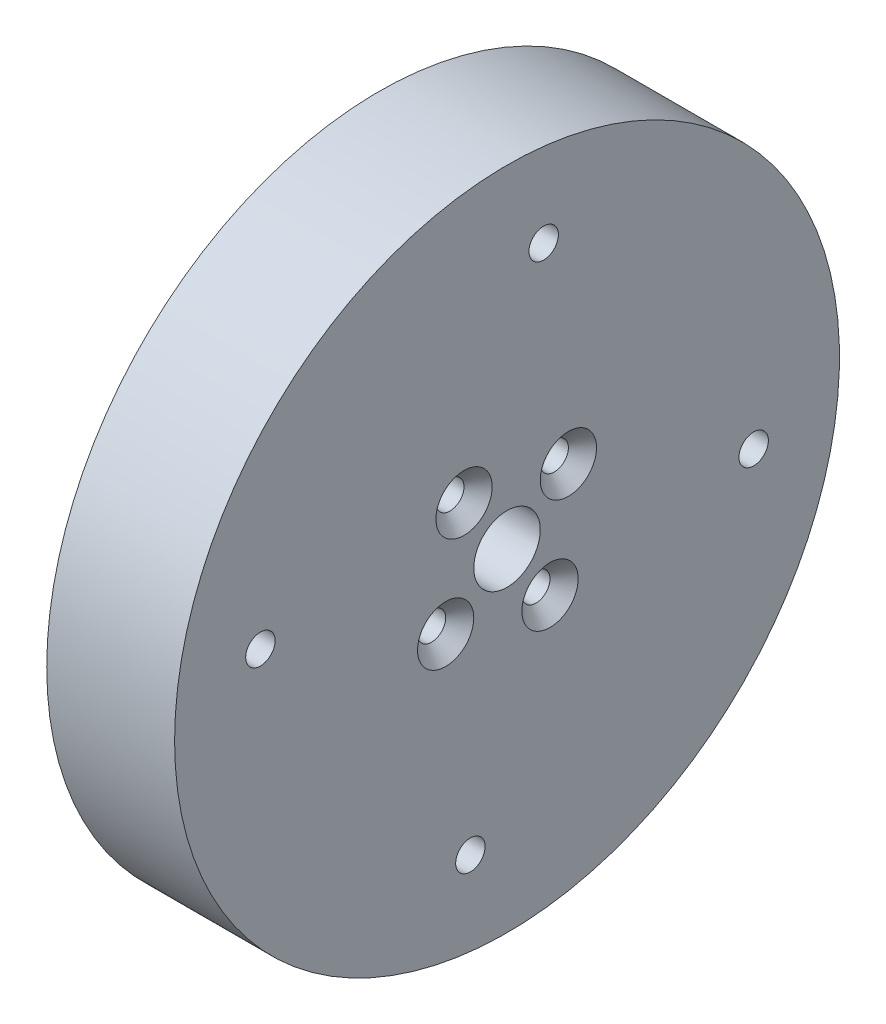
from build123d import *

# Parameters (mm, degrees)
HOLE_WIZARD_M22_D           = 2.2
HOLE_WIZARD_M22_CSINK_D     = 4.4
HOLE_WIZARD_M22_CSINK_ANGLE = 90
PATTERN_CIRCULAR_2_COUNT    = 4
PATTERN_CIRCULAR_3_COUNT    = 4


with BuildPart() as part:
    # Эскиз1 → Повернуть1 (revolve)
    with BuildSketch(Plane.XY):
        Polygon((0, 13), (0, 26), (10, 26), (10, 2.6), (5, 2.6), (5, 13), align=None)
    revolve(axis=Axis((0, 0, 0), (1, 0, 0)))

    # Зенковка для  винта с плоской головкой M22 (through all)
    with Locations(Plane(origin=(10, 0, 0), x_dir=(0, 0, -1), z_dir=(1, 0, 0))):
        with Locations((-3.362654925, 4.8)):
            hole_wizard_m22 = CounterSinkHole(HOLE_WIZARD_M22_D / 2, HOLE_WIZARD_M22_CSINK_D / 2, counter_sink_angle=HOLE_WIZARD_M22_CSINK_ANGLE)

    # Круговой массив2: Зенковка для  винта с плоской головкой M22 ×4 about axis
    pattern_circular_2_axis = Axis((10, 0, 0), (-1, 0, 0))
    for i in range(1, PATTERN_CIRCULAR_2_COUNT):
        add(hole_wizard_m22.rotate(pattern_circular_2_axis, i * 360 / PATTERN_CIRCULAR_2_COUNT), mode=Mode.SUBTRACT)

    # Эскиз7 → Сверло под метчик  спиральное M2.21 (revolve, cut)
    with BuildSketch(Plane(origin=(10, -2.866446976, -19.288169476), x_dir=(0, 0, -1), z_dir=(0, 1, 0))):
        Polygon((0, 0), (0, 3.690989712), (1.15, 3), (1.15, 0), align=None)
    hole_wizard_m2_21 = revolve(axis=Axis((16.35, -2.866446976, -19.288169476), (-1, 0, 0)), mode=Mode.SUBTRACT)

    # Круговой массив3: Сверло под метчик  спиральное M2.21 ×4 about axis
    pattern_circular_3_axis = Axis((10, 0, 0), (-1, 0, 0))
    for i in range(1, PATTERN_CIRCULAR_3_COUNT):
        add(hole_wizard_m2_21.rotate(pattern_circular_3_axis, i * 360 / PATTERN_CIRCULAR_3_COUNT), mode=Mode.SUBTRACT)


solid = part.part
